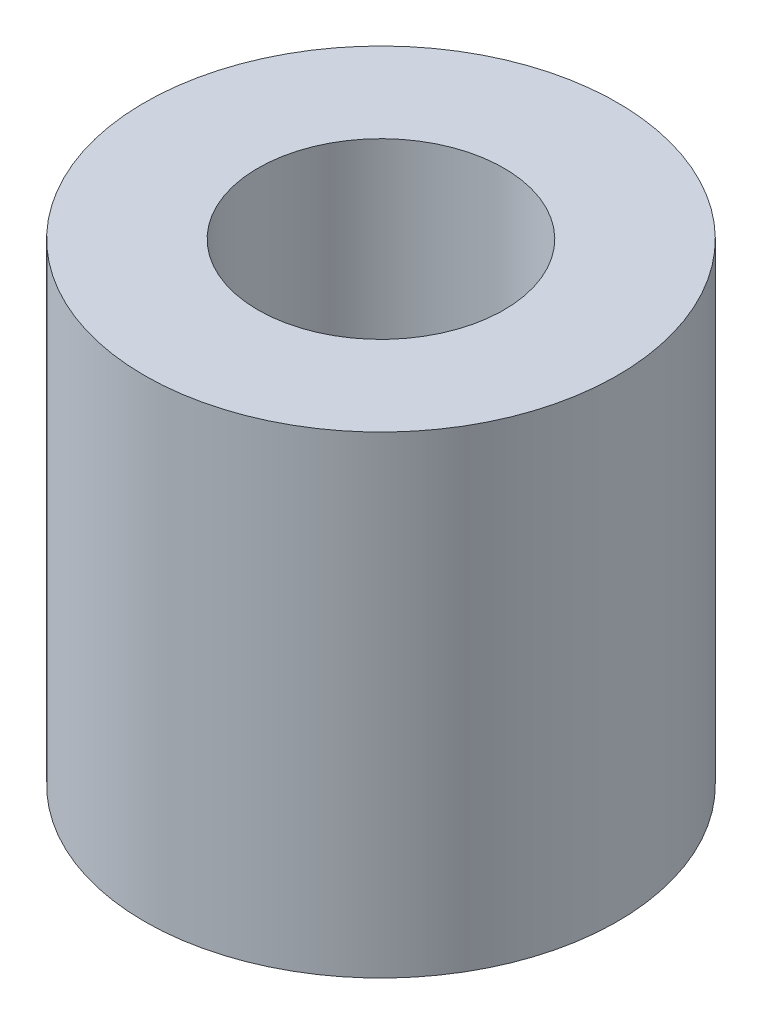
from build123d import *

# Parameters (mm, degrees)
SKETCH1_R           = 5
SKETCH1_R_2         = 2.6
BOSS_EXTRUDE1_DEPTH = 10


with BuildPart() as part:
    # Sketch1 → Boss-Extrude1 (new body)
    with BuildSketch(Plane(origin=(0, 0, 0), x_dir=(1, 0, 0), z_dir=(0, 1, 0))):
        with Locations(Location((0, 0, 0), (0, 0, 270))):
            Circle(SKETCH1_R)
        with Locations(Location((0, 0, 0), (0, 0, 270))):
            Circle(SKETCH1_R_2, mode=Mode.SUBTRACT)
    extrude(amount=BOSS_EXTRUDE1_DEPTH)


solid = part.part
